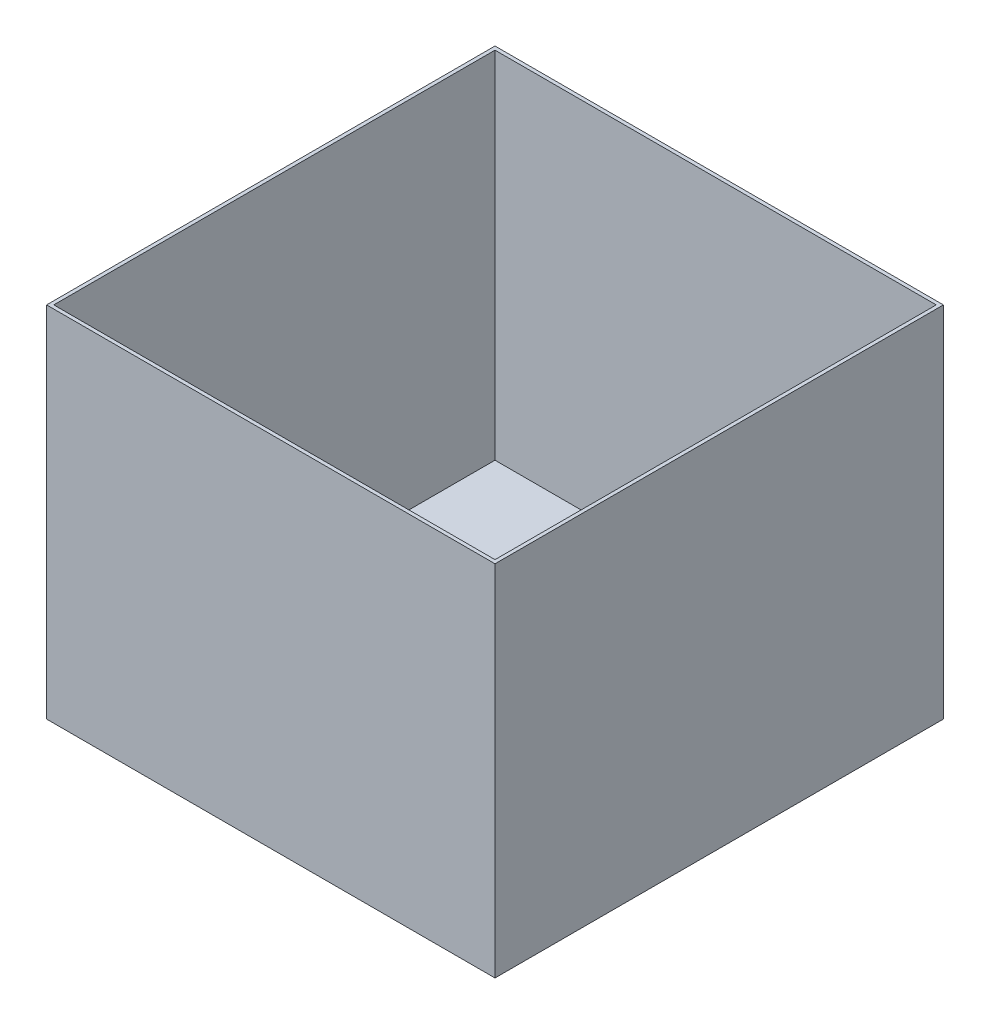
from build123d import *

# Parameters (mm, degrees)
SKETCH1_W           = 250
SKETCH1_H           = 250
BOSS_EXTRUDE1_DEPTH = 200
SHELL1_T            = -2


with BuildPart() as part:
    # Sketch1 → Boss-Extrude1 (new body)
    with BuildSketch(Plane(origin=(0, 0, 0), x_dir=(1, 0, 0), z_dir=(0, 1, 0))):
        with Locations((125, -125)):
            Rectangle(SKETCH1_W, SKETCH1_H)
    extrude(amount=BOSS_EXTRUDE1_DEPTH)

    # Shell1
    shell1_openings = [part.faces().sort_by_distance(p)[0] for p in [
        (125, 200, 125),
    ]]
    offset(amount=SHELL1_T, openings=shell1_openings, kind=Kind.INTERSECTION)


solid = part.part
